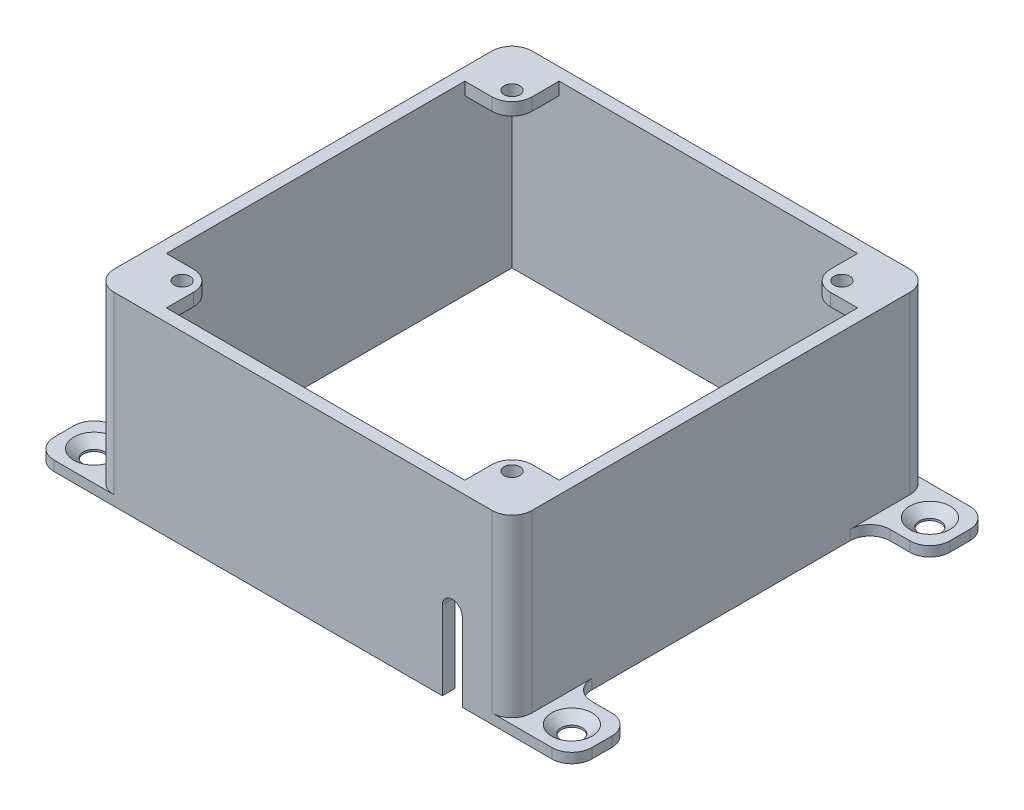
from build123d import *

# Parameters (mm, degrees)
SKETCH1_W           = 133
SKETCH1_H           = 133
SKETCH1_W_2         = 125
SKETCH1_H_2         = 125
BOSS_EXTRUDE1_DEPTH = 55
SKETCH1_3_W         = 19.05
SKETCH1_3_H         = 19.05
BOSS_EXTRUDE2_DEPTH = 3.175
SKETCH2_W           = 133
SKETCH2_H           = 133
SKETCH2_R           = 2.5
BOSS_EXTRUDE3_DEPTH = 4
FILLET1_R           = 6.35
CUT_EXTRUDE1_DEPTH  = 4


with BuildPart() as part:
    # Sketch1 → Boss-Extrude1 (new body)
    with BuildSketch(Plane(origin=(0, 0, 0), x_dir=(1, 0, 0), z_dir=(0, 1, 0))):
        Rectangle(SKETCH1_W, SKETCH1_H)
        Rectangle(SKETCH1_W_2, SKETCH1_H_2, mode=Mode.SUBTRACT)
    extrude(amount=BOSS_EXTRUDE1_DEPTH)

    # Sketch1<3> → Boss-Extrude2 (add)
    with BuildSketch(Plane(origin=(0, 0, 0), x_dir=(1, 0, 0), z_dir=(0, 1, 0))):
        with Locations((-76.025, 56.975)):
            Rectangle(SKETCH1_3_W, SKETCH1_3_H)
        with Locations((-76.025, -56.975)):
            Rectangle(SKETCH1_3_W, SKETCH1_3_H)
        with Locations((76.025, -56.975)):
            Rectangle(SKETCH1_3_W, SKETCH1_3_H)
        with Locations((76.025, 56.975)):
            Rectangle(SKETCH1_3_W, SKETCH1_3_H)
    extrude(amount=BOSS_EXTRUDE2_DEPTH)

    # Sketch2 → Boss-Extrude3 (add)
    with BuildSketch(Plane(origin=(0, 55, 0), x_dir=(1, 0, 0), z_dir=(0, 1, 0))):
        Rectangle(SKETCH2_W, SKETCH2_H)
        with Locations(Location((-52.5, 52.5, 0), (0, 0, 270))):
            Circle(SKETCH2_R, mode=Mode.SUBTRACT)
        with Locations(Location((52.5, 52.5, 0), (0, 0, 270))):
            Circle(SKETCH2_R, mode=Mode.SUBTRACT)
        with Locations(Location((52.5, -52.5, 0), (0, 0, 270))):
            Circle(SKETCH2_R, mode=Mode.SUBTRACT)
        with Locations(Location((-52.5, -52.5, 0), (0, 0, 270))):
            Circle(SKETCH2_R, mode=Mode.SUBTRACT)
        Polygon((-62.5, 47.5), (-47.5, 47.5), (-47.5, 62.5), (47.5, 62.5), (47.5, 47.5), (62.5, 47.5), (62.5, -47.5), (47.5, -47.5), (47.5, -62.5), (-47.5, -62.5), (-47.5, -47.5), (-62.5, -47.5), align=None, mode=Mode.SUBTRACT)
    extrude(amount=BOSS_EXTRUDE3_DEPTH)

    # Sketch5 → CSK for 1/4 Flat Head Machine Screw (100)1 (revolve, cut)
    with BuildSketch(Plane(origin=(-76.025, 3.175, 56.975), x_dir=(0, 0, 1), z_dir=(1, 0, 0))):
        Polygon((0, 0), (0, 3.175), (3.3782, 3.175), (3.3782, 2.568232241), (6.4389, 0), align=None)
    csk_for_1_4_flat_head_machine_screw_100 = revolve(axis=Axis((-76.025, 9.525, 56.975), (0, -1, 0)), mode=Mode.SUBTRACT)

    # Mirror1: CSK for 1/4 Flat Head Machine Screw (100)1 across plane
    add(csk_for_1_4_flat_head_machine_screw_100.mirror(Plane.XY), mode=Mode.SUBTRACT)

    # Mirror1 at the second plane: CSK for 1/4 Flat Head Machine Screw (100)1 across plane
    add(csk_for_1_4_flat_head_machine_screw_100.mirror(Plane(origin=(0, 0, 0), x_dir=(0, 0, 1), z_dir=(1, 0, 0))), mode=Mode.SUBTRACT)

    # Mirror1 at the second plane copy 1 sketc → Mirror1 at the second plane copy 1 (revolve, cut)
    with BuildSketch(Plane(origin=(76.025, 3.175, -56.975), x_dir=(0, 0, -1), z_dir=(-1, 0, 0))):
        Polygon((0, 0), (0, 3.175), (3.3782, 3.175), (3.3782, 2.568232241), (6.4389, 0), align=None)
    revolve(axis=Axis((76.025, 9.525, -56.975), (0, -1, 0)), mode=Mode.SUBTRACT)

    # Fillet1
    fillet1_edges = [part.edges().sort_by_distance(p)[0] for p in [
        (-66.5, 31.0875, 66.5),
        (-66.5, 31.0875, -66.5),
        (66.5, 31.0875, -66.5),
        (66.5, 31.0875, 66.5),
        (-85.55, 1.5875, -66.5),
        (-85.55, 1.5875, -47.45),
        (-66.5, 1.5875, -47.45),
        (-85.55, 1.5875, 66.5),
        (-66.5, 1.5875, 47.45),
        (-85.55, 1.5875, 47.45),
        (85.55, 1.5875, 47.45),
        (66.5, 1.5875, 47.45),
        (85.55, 1.5875, 66.5),
        (85.55, 1.5875, -66.5),
        (66.5, 1.5875, -47.45),
        (85.55, 1.5875, -47.45),
        (-47.5, 57, -47.5),
        (-47.5, 57, 47.5),
        (47.5, 57, 47.5),
        (47.5, 57, -47.5),
    ]]
    fillet(fillet1_edges, radius=FILLET1_R)

    # Sketch6 → Cut-Extrude1 (cut)
    with BuildSketch(Plane.XY.offset(66.5)):
        with BuildLine():
            Line((44.325, 0), (44.325, 25))
            ThreePointArc((44.325, 25), (47.5, 28.175), (50.675, 25))
            Line((50.675, 25), (50.675, 0))
            ThreePointArc((50.675, 0), (47.5, -3.175), (44.325, 0))
        make_face()
    extrude(amount=-CUT_EXTRUDE1_DEPTH, mode=Mode.SUBTRACT)


solid = part.part
